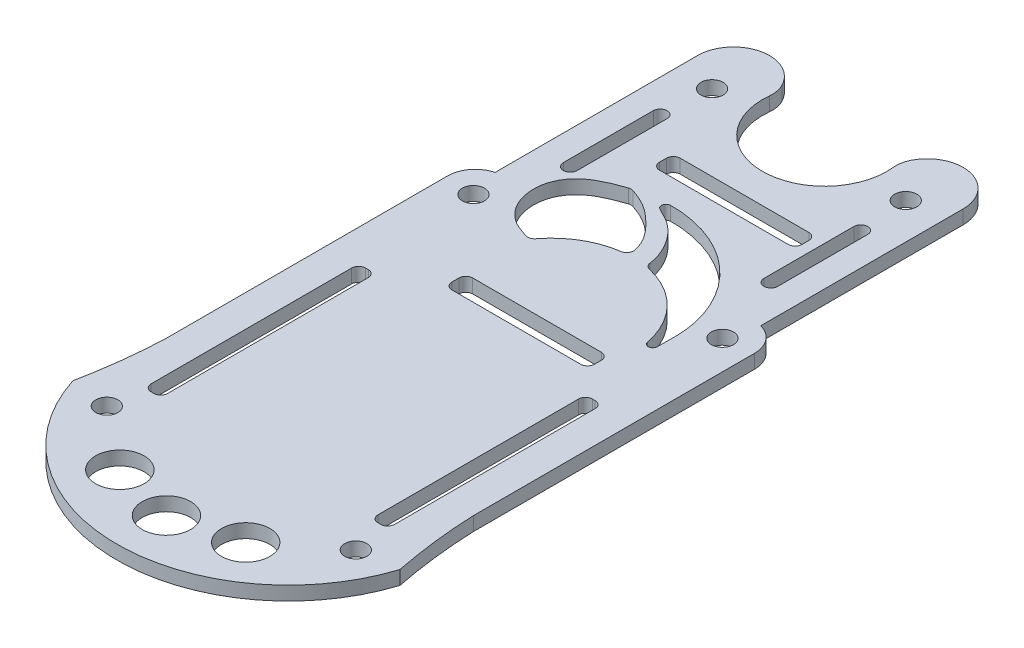
from build123d import *

# Parameters (mm, degrees)
SKETCH2_R           = 3.5
SKETCH2_R_2         = 1.6
SKETCH2_R_3         = 1.598962018
BOSS_EXTRUDE1_DEPTH = 2


with BuildPart() as part:
    # Sketch2 → Boss-Extrude1 (new body)
    with BuildSketch(Plane(origin=(0, 0, 0), x_dir=(1, 0, 0), z_dir=(0, 1, 0))):
        with BuildLine():
            Line((-23.670097795, -32.056362812), (-23.670097795, 8.618941775))
            ThreePointArc((-23.670097795, 8.618941775), (-23.016737901, 10.809832005), (-21.270097795, 12.285002331))
            ThreePointArc((-21.270097795, 12.285002331), (-20.973864293, 12.401991353), (-20.670097795, 12.497733894))
            Line((-20.670097795, 12.497733894), (-20.670097795, 41.764903086))
            ThreePointArc((-20.670097795, 41.764903086), (-16.675502611, 46.823262428), (-10.828944246, 44.110045668))
            ThreePointArc((-10.828944246, 44.110045668), (-10.464869413, 43.028672598), (-10.420919417, 41.88850305))
            ThreePointArc((-10.420919417, 41.88850305), (-1.470097795, 31.948932783), (7.480723827, 41.88850305))
            ThreePointArc((7.480723827, 41.88850305), (7.524673822, 43.028672598), (7.888748655, 44.110045668))
            ThreePointArc((7.888748655, 44.110045668), (13.735307021, 46.823262428), (17.729902205, 41.764903086))
            Line((17.729902205, 41.764903086), (17.729902205, 12.497733894))
            ThreePointArc((17.729902205, 12.497733894), (18.033668702, 12.401991353), (18.329902205, 12.285002331))
            ThreePointArc((18.329902205, 12.285002331), (20.076542311, 10.809832005), (20.729902205, 8.618941775))
            Line((20.729902205, 8.618941775), (20.729902205, -32.056362812))
            ThreePointArc((20.729902205, -32.056362812), (21.209983868, -38.107008106), (22.164905513, -44.10108114))
            ThreePointArc((22.164905513, -44.10108114), (-1.470097795, -61.389315795), (-25.105101104, -44.10108114))
            ThreePointArc((-25.105101104, -44.10108114), (-24.150179459, -38.107008106), (-23.670097795, -32.056362812))
        make_face()
        with Locations(Location((-1.470097795, -54.218974573, 0), (0, 0, 270))):
            Circle(SKETCH2_R, mode=Mode.SUBTRACT)
        with Locations(Location((7.629909443, -51.858302161, 0), (0, 0, 270))):
            Circle(SKETCH2_R, mode=Mode.SUBTRACT)
        with Locations(Location((-10.570105034, -51.858302161, 0), (0, 0, 270))):
            Circle(SKETCH2_R, mode=Mode.SUBTRACT)
        with Locations(Location((-19.470097795, -44.839315795, 0), (0, 0, 270))):
            Circle(SKETCH2_R_2, mode=Mode.SUBTRACT)
        with Locations(Location((16.529902205, -44.839315795, 0), (0, 0, 270))):
            Circle(SKETCH2_R_2, mode=Mode.SUBTRACT)
        with Locations(Location((-19.470097795, 8.160684205, 0), (0, 0, 270))):
            Circle(SKETCH2_R_2, mode=Mode.SUBTRACT)
        with Locations(Location((16.529902205, 8.160684205, 0), (0, 0, 270))):
            Circle(SKETCH2_R_2, mode=Mode.SUBTRACT)
        with Locations(Location((-15.470097795, 38.660684205, 0), (0, 0, 270))):
            Circle(SKETCH2_R_3, mode=Mode.SUBTRACT)
        with Locations(Location((12.529902205, 38.660684205, 0), (0, 0, 270))):
            Circle(SKETCH2_R_3, mode=Mode.SUBTRACT)
        with BuildLine():
            Line((-16.970097795, 31.660684205), (-16.970097795, 18.660684205))
            ThreePointArc((-16.970097795, 18.660684205), (-15.970097795, 17.660684205), (-14.970097795, 18.660684205))
            Line((-14.970097795, 18.660684205), (-14.970097795, 31.660684205))
            ThreePointArc((-14.970097795, 31.660684205), (-15.970097795, 32.660684205), (-16.970097795, 31.660684205))
        make_face(mode=Mode.SUBTRACT)
        with BuildLine():
            Line((12.029902205, 31.660684205), (12.029902205, 18.660684205))
            ThreePointArc((12.029902205, 18.660684205), (13.029902205, 17.660684205), (14.029902205, 18.660684205))
            Line((14.029902205, 18.660684205), (14.029902205, 31.660684205))
            ThreePointArc((14.029902205, 31.660684205), (13.029902205, 32.660684205), (12.029902205, 31.660684205))
        make_face(mode=Mode.SUBTRACT)
        with BuildLine():
            Line((13.729902205, -9.839315795), (13.729902205, -38.839315795))
            ThreePointArc((13.729902205, -38.839315795), (14.022795424, -39.546422576), (14.729902205, -39.839315795))
            Line((14.729902205, -39.839315795), (15.129902205, -39.839315795))
            ThreePointArc((15.129902205, -39.839315795), (15.837008986, -39.546422576), (16.129902205, -38.839315795))
            Line((16.129902205, -38.839315795), (16.129902205, -9.839315795))
            ThreePointArc((16.129902205, -9.839315795), (15.837008986, -9.132209013), (15.129902205, -8.839315795))
            Line((15.129902205, -8.839315795), (14.729902205, -8.839315795))
            ThreePointArc((14.729902205, -8.839315795), (14.022795424, -9.132209013), (13.729902205, -9.839315795))
        make_face(mode=Mode.SUBTRACT)
        with BuildLine():
            Line((-16.670097795, -9.839315795), (-16.670097795, -38.839315795))
            ThreePointArc((-16.670097795, -38.839315795), (-16.962991014, -39.546422576), (-17.670097795, -39.839315795))
            Line((-17.670097795, -39.839315795), (-18.070097795, -39.839315795))
            ThreePointArc((-18.070097795, -39.839315795), (-18.777204576, -39.546422576), (-19.070097795, -38.839315795))
            Line((-19.070097795, -38.839315795), (-19.070097795, -9.839315795))
            ThreePointArc((-19.070097795, -9.839315795), (-18.777204576, -9.132209013), (-18.070097795, -8.839315795))
            Line((-18.070097795, -8.839315795), (-17.670097795, -8.839315795))
            ThreePointArc((-17.670097795, -8.839315795), (-16.962991014, -9.132209013), (-16.670097795, -9.839315795))
        make_face(mode=Mode.SUBTRACT)
        with BuildLine():
            Line((-9.070097795, 24.660684205), (9.529902205, 24.660684205))
            ThreePointArc((9.529902205, 24.660684205), (10.237008986, 24.953577424), (10.529902205, 25.660684205))
            Line((10.529902205, 25.660684205), (10.529902205, 26.660684205))
            ThreePointArc((10.529902205, 26.660684205), (10.237008986, 27.367790987), (9.529902205, 27.660684205))
            Line((9.529902205, 27.660684205), (-9.070097795, 27.660684205))
            ThreePointArc((-9.070097795, 27.660684205), (-9.777204576, 27.367790987), (-10.070097795, 26.660684205))
            Line((-10.070097795, 26.660684205), (-10.070097795, 25.660684205))
            ThreePointArc((-10.070097795, 25.660684205), (-9.777204576, 24.953577424), (-9.070097795, 24.660684205))
        make_face(mode=Mode.SUBTRACT)
        with BuildLine():
            Line((-9.070097795, -5.339315795), (9.529902205, -5.339315795))
            ThreePointArc((9.529902205, -5.339315795), (10.237008986, -5.046422576), (10.529902205, -4.339315795))
            Line((10.529902205, -4.339315795), (10.529902205, -3.339315795))
            ThreePointArc((10.529902205, -3.339315795), (10.237008986, -2.632209013), (9.529902205, -2.339315795))
            Line((9.529902205, -2.339315795), (-9.070097795, -2.339315795))
            ThreePointArc((-9.070097795, -2.339315795), (-9.777204576, -2.632209013), (-10.070097795, -3.339315795))
            Line((-10.070097795, -3.339315795), (-10.070097795, -4.339315795))
            ThreePointArc((-10.070097795, -4.339315795), (-9.777204576, -5.046422576), (-9.070097795, -5.339315795))
        make_face(mode=Mode.SUBTRACT)
        with BuildLine():
            ThreePointArc((11.592409226, 2.277082303), (8.483157974, 8.222231222), (2.638014207, 11.51563878))
            ThreePointArc((2.638014207, 11.51563878), (2.121996842, 11.817028658), (1.869995807, 12.358882197))
            add(Edge.make_bspline(
                [(1.869995807, 12.358882197), (1.842662891, 12.564920807), (1.645816717, 13.772533118), (0.643080373, 16.073708791), (-1.324607952, 18.345688068), (-3.18934686, 19.343792608), (-3.972407265, 19.727563494), (-4.154351902, 19.815161669)],
                knots=[1.415793745, 1.415793745, 1.415793745, 1.415793745, 2.040258905, 5.097099775, 8.794778711, 10.800795525, 11.405761141, 11.405761141, 11.405761141, 11.405761141], degree=3))
            ThreePointArc((-4.154351902, 19.815161669), (-4.506981756, 20.541481709), (-3.880471106, 21.050768485))
            add(Edge.make_bspline(
                [(12.880043513, 2.387180569), (12.881065186, 2.430898093), (12.88208686, 2.474615617), (12.883108534, 2.518333141), (12.918901743, 4.049928037), (13.017697673, 8.277415536), (10.28287236, 14.599600939), (4.282341197, 19.709461541), (-0.897163555, 21.050696374), (-3.734485369, 21.052584871), (-3.880471106, 21.050768485)],
                knots=[-0.130629719, -0.130629719, -0.130629719, -0.130629719, 0, 0, 0, 4.576467099, 12.631902537, 19.61060331, 27.611731203, 28.045840496, 28.045840496, 28.045840496, 28.045840496], degree=3))
            ThreePointArc((12.880043513, 2.387180569), (12.285596676, 1.754729973), (11.592409226, 2.277082303))
        make_face(mode=Mode.SUBTRACT)
        with BuildLine():
            ThreePointArc((-1.689370597, 11.692522502), (-5.997136857, 10.178575784), (-9.409048266, 7.14414909))
            ThreePointArc((-9.409048266, 7.14414909), (-9.907398641, 6.794332332), (-10.516256933, 6.79838691))
            add(Edge.make_bspline(
                [(-9.073047111, 20.195403041), (-9.924041196, 19.924818402), (-11.457295922, 19.314866074), (-13.88656058, 17.968625132), (-15.738010724, 15.472586344), (-15.963993383, 12.140965148), (-14.831238886, 9.284075293), (-12.803522888, 7.546235802), (-11.333770861, 7.065682842), (-10.715557595, 6.86355064), (-10.649124041, 6.841829396), (-10.582690487, 6.820108153), (-10.516256933, 6.79838691)],
                knots=[33.27876941, 33.27876941, 33.27876941, 33.27876941, 35.932769732, 38.174441101, 41.572939786, 44.716597805, 47.793369971, 50.469296473, 52.412006936, 52.412006936, 52.412006936, 52.620771722, 52.620771722, 52.620771722, 52.620771722], degree=3))
            ThreePointArc((-9.073047111, 20.195403041), (-8.762207832, 20.242386416), (-8.452141885, 20.190544322))
            add(Edge.make_bspline(
                [(-0.856220767, 12.89935179), (-0.919315201, 13.18303538), (-1.361040524, 14.788219391), (-3.220498182, 16.995304302), (-5.690570357, 19.103609418), (-7.513737765, 19.869024907), (-8.35180533, 20.156903184), (-8.452141885, 20.190544322)],
                knots=[1.628367635, 1.628367635, 1.628367635, 1.628367635, 2.502760397, 6.666081456, 9.886557607, 12.220662199, 12.537412771, 12.537412771, 12.537412771, 12.537412771], degree=3))
            ThreePointArc((-0.856220767, 12.89935179), (-1.009428131, 12.114118033), (-1.689370597, 11.692522502))
        make_face(mode=Mode.SUBTRACT)
    extrude(amount=BOSS_EXTRUDE1_DEPTH)


solid = part.part
